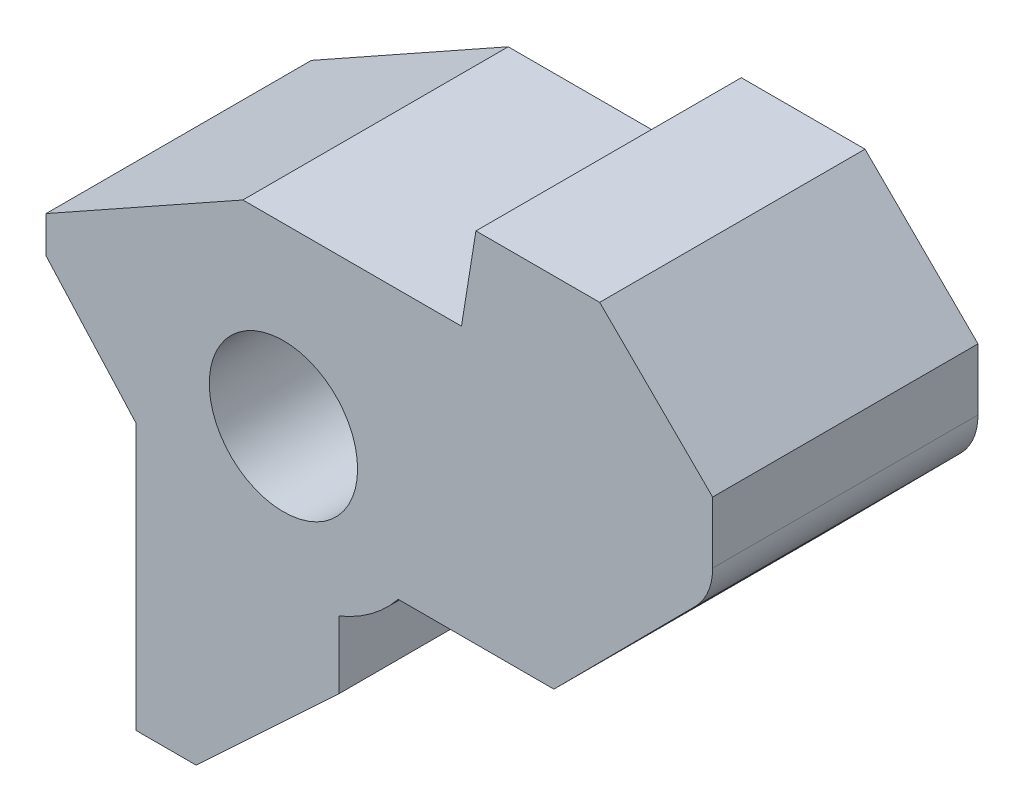
from build123d import *

# Parameters (mm, degrees)
SKETCH_1_R      = 2.515
EXTRUDE_1_DEPTH = 9
FILLET_1_R      = 2


with BuildPart() as part:
    # 스케치1 → 보스-돌출1 (new body)
    with BuildSketch(Plane.XY):
        with BuildLine():
            Line((-8.053143001, 0.978578295), (-5, -2.40902013))
            Line((-5, -2.40902013), (-5, -11.436332264))
            Line((-5, -11.436332264), (-2.956819065, -11.436332264))
            Line((-2.956819065, -11.436332264), (1.87605446, -6.923867857))
            Line((1.87605446, -6.923867857), (1.87605446, -4.634697365))
            ThreePointArc((1.87605446, -4.634697365), (2.980195691, -4.014776911), (3.893195608, -3.13736003))
            Line((3.893195608, -3.13736003), (9.172978659, -3.13736003))
            Line((9.172978659, -3.13736003), (14.557074242, 2.286312605))
            Line((14.557074242, 2.286312605), (14.557074242, 5.198022376))
            Line((14.557074242, 5.198022376), (10.725649804, 9.001488547))
            Line((10.725649804, 9.001488547), (6.528593017, 9.001488547))
            Line((6.528593017, 9.001488547), (6.037882178, 5.957406269))
            Line((6.037882178, 5.957406269), (-1.376355668, 5.957406269))
            Line((-1.376355668, 5.957406269), (-8.053143001, 2.219229384))
            Line((-8.053143001, 2.219229384), (-8.053143001, 0.978578295))
        make_face()
        Circle(SKETCH_1_R, mode=Mode.SUBTRACT)
    extrude(amount=EXTRUDE_1_DEPTH)

    # 필렛1
    fillet_1_edges = [part.edges().sort_by_distance(p)[0] for p in [
        (14.557074242, 2.286312605, 4.5),
    ]]
    fillet(fillet_1_edges, radius=FILLET_1_R)


solid = part.part
